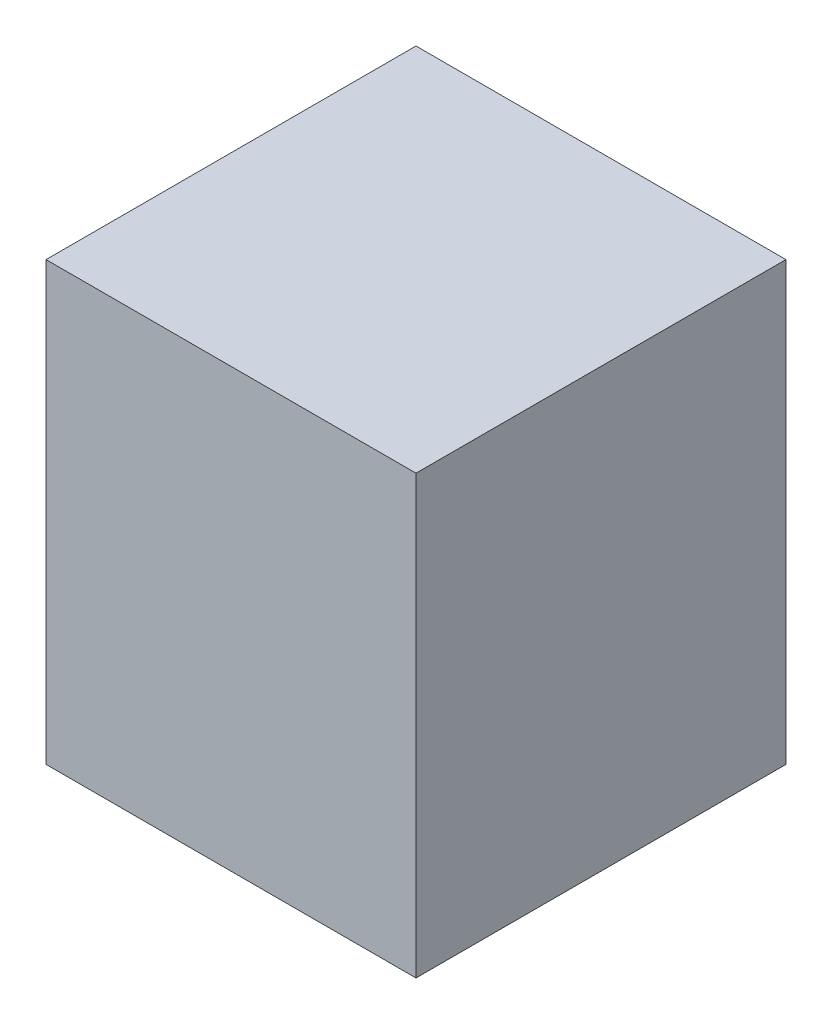
from build123d import *

# Parameters (mm, degrees)
SKETCH1_W                     = 55
SKETCH1_H                     = 65
BOSS_EXTRUDE1_DEPTH           = 55
BOSS_EXTRUDE1_OTHER_WAY_DEPTH = 10
BOSS_EXTRUDE1_OTHER_WAY_TAPER = 45


with BuildPart() as part:
    # Sketch1 → Boss-Extrude1 (new body)
    with BuildSketch(Plane.XY):
        Rectangle(SKETCH1_W, SKETCH1_H)
    extrude(amount=BOSS_EXTRUDE1_DEPTH)

    # Sketch1 → Boss-Extrude1 other way (add)
    with BuildSketch(Plane.XY):
        Rectangle(SKETCH1_W, SKETCH1_H)
    extrude(amount=-BOSS_EXTRUDE1_OTHER_WAY_DEPTH, taper=BOSS_EXTRUDE1_OTHER_WAY_TAPER)


solid = part.part
